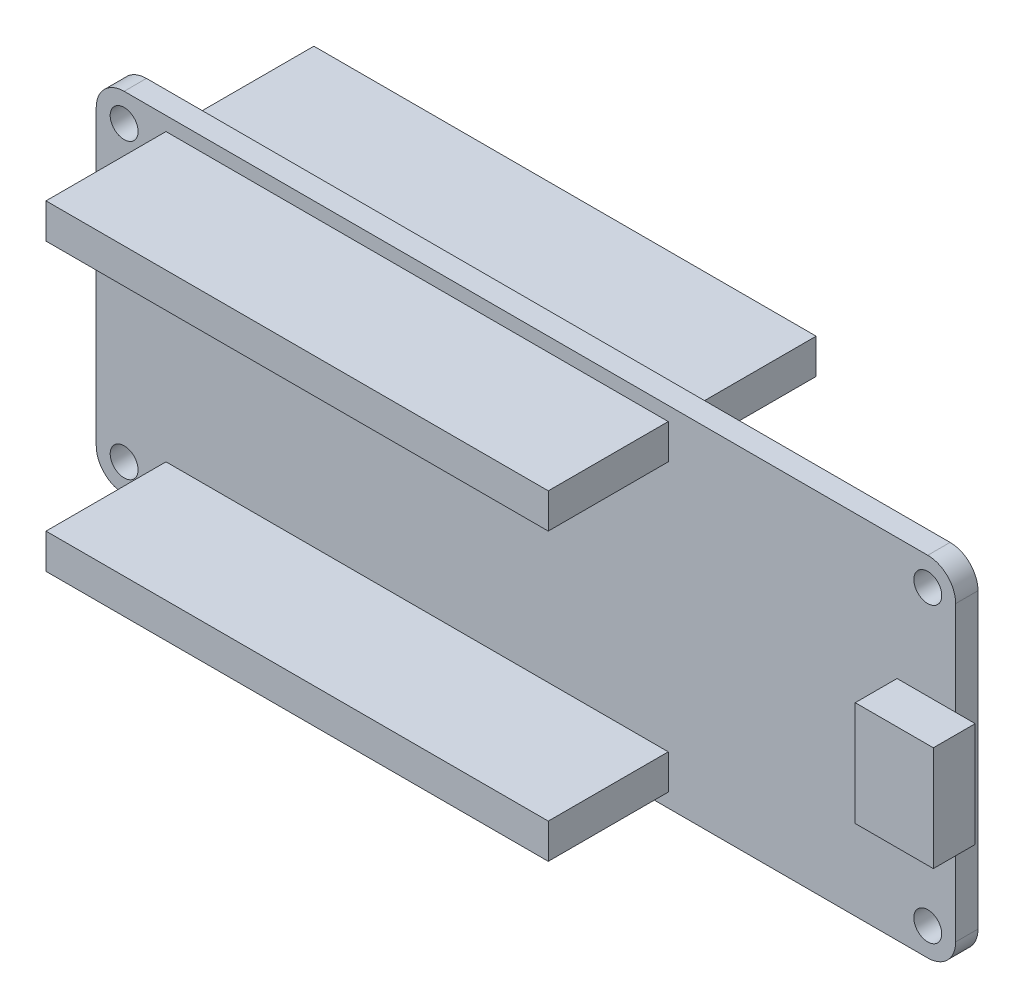
from build123d import *

# Parameters (mm, degrees)
SCHIZZO1_W                        = 61.6
SCHIZZO1_H                        = 25
ESTRUSIONE_ESTRUSIONE1_DEPTH      = 1.6
SCHIZZO2_R                        = 1
TAGLIO_ESTRUSIONE1_DEPTH          = 1.6
RACCORDO1_R                       = 2
SCHIZZO3_W                        = 5.6
SCHIZZO3_H                        = 7.5
ESTRUSIONE_ESTRUSIONE2_DEPTH      = 3
ESTRUSIONE_ESTRUSIONE3_DEPTH      = 8.6
ESTRUSIONE_ESTRUSIONE3_DEPTH_BACK = 10.6
SCHIZZO4_W                        = 36
SCHIZZO4_H                        = 2.5


with BuildPart() as part:
    # Schizzo1 → Estrusione-Estrusione1 (new body)
    with BuildSketch(Plane.XY):
        Rectangle(SCHIZZO1_W, SCHIZZO1_H)
    extrude(amount=ESTRUSIONE_ESTRUSIONE1_DEPTH)

    # Schizzo2 → Taglio-Estrusione1 (cut)
    with BuildSketch(Plane.XY.offset(1.6)):
        with Locations((-28.8, 10.5)):
            Circle(SCHIZZO2_R)
        with Locations((28.8, 10.5)):
            Circle(SCHIZZO2_R)
        with Locations((28.8, -10.5)):
            Circle(SCHIZZO2_R)
        with Locations((-28.8, -10.5)):
            Circle(SCHIZZO2_R)
    extrude(amount=-TAGLIO_ESTRUSIONE1_DEPTH, mode=Mode.SUBTRACT)

    # Raccordo1
    raccordo1_edges = [part.edges().sort_by_distance(p)[0] for p in [
        (-30.8, 12.5, 0.8),
        (30.8, 12.5, 0.8),
        (30.8, -12.5, 0.8),
        (-30.8, -12.5, 0.8),
    ]]
    fillet(raccordo1_edges, radius=RACCORDO1_R)

    # Schizzo3 → Estrusione-Estrusione2 (add)
    with BuildSketch(Plane.XY.offset(1.6)):
        with Locations((29.4, 0)):
            Rectangle(SCHIZZO3_W, SCHIZZO3_H)
    extrude(amount=ESTRUSIONE_ESTRUSIONE2_DEPTH)

    # Schizzo4 → Estrusione-Estrusione3 (add, two sides: drawn at the far end of the back side and taken through both)
    with BuildSketch(Plane.XY.offset(1.6).offset(-ESTRUSIONE_ESTRUSIONE3_DEPTH_BACK)):
        with Locations((-7.8, 10.25)):
            Rectangle(SCHIZZO4_W, SCHIZZO4_H)
        with Locations((-7.8, -10.25)):
            Rectangle(SCHIZZO4_W, SCHIZZO4_H)
    extrude(amount=ESTRUSIONE_ESTRUSIONE3_DEPTH + ESTRUSIONE_ESTRUSIONE3_DEPTH_BACK)


solid = part.part
